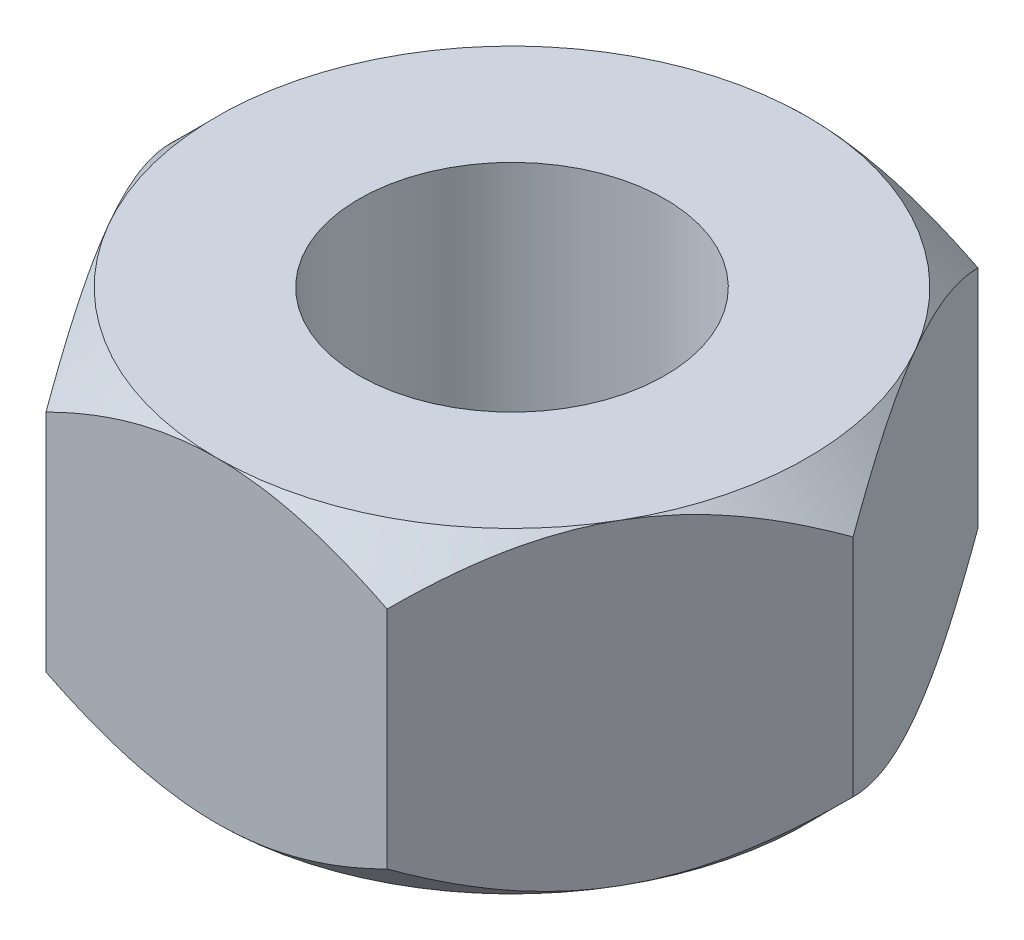
from build123d import *

# Parameters (mm, degrees)
BOSS_EXTRUDE1_DEPTH     = 15
SKETCH2_OUTSIDE_W       = 73.396
SKETCH2_OUTSIDE_H       = 69.064
SKETCH2_OUTSIDE_R       = 14
CUT_EXTRUDE1_DEPTH      = 15
CUT_EXTRUDE1_DRAFT      = -45
MIRROR1_COPY_1_SKETCH_W = 73.396
MIRROR1_COPY_1_SKETCH_H = 69.064
MIRROR1_COPY_1_SKETCH_R = 14
MIRROR1_COPY_1_DEPTH    = 15
MIRROR1_COPY_1_DRAFT    = -45
M16X1_5_TAPPED_HOLE1_D  = 14.5


with BuildPart() as part:
    # Sketch1 → Boss-Extrude1 (new body)
    with BuildSketch(Plane(origin=(0, 0, 0), x_dir=(1, 0, 0), z_dir=(0, 1, 0))):
        Polygon((16.165807537, 0), (8.082903769, 14), (-8.082903769, 14), (-16.165807537, 0), (-8.082903769, -14), (8.082903769, -14), align=None)
    extrude(amount=BOSS_EXTRUDE1_DEPTH)


with BuildPart() as cut_extrude1_tool:
    # Sketch2 outside → Cut-Extrude1 (with draft: the straight prism first)
    with BuildSketch(Plane(origin=(0, 15, 0), x_dir=(1, 0, 0), z_dir=(0, 1, 0))):
        Rectangle(SKETCH2_OUTSIDE_W, SKETCH2_OUTSIDE_H)
        Circle(SKETCH2_OUTSIDE_R, mode=Mode.SUBTRACT)
    extrude(amount=-CUT_EXTRUDE1_DEPTH)
    # Cut-Extrude1: the draft: its side faces are tilted about the plane it starts from
    cut_extrude1_sides = [cut_extrude1_tool.faces().sort_by_distance(p)[0] for p in [
        (0, 7.5, 34.532),
        (36.698, 7.5, 0),
        (0, 7.5, -34.532),
        (-36.698, 7.5, 0),
        (-14, 7.5, 0),
    ]]
    draft(cut_extrude1_sides, Plane(origin=(0, 15, 0), x_dir=(1, 0, 0), z_dir=(0, 1, 0)), CUT_EXTRUDE1_DRAFT)


with BuildPart() as part_1:
    add(part.part)

    # Cut-Extrude1: cut by cut_extrude1_tool
    add(cut_extrude1_tool.part, mode=Mode.SUBTRACT)


with BuildPart() as mirror1_copy_1_tool:
    # Mirror1 copy 1 sketch → Mirror1 copy 1 (with draft: the straight prism first)
    with BuildSketch(Plane.XZ):
        Rectangle(MIRROR1_COPY_1_SKETCH_W, MIRROR1_COPY_1_SKETCH_H)
        Circle(MIRROR1_COPY_1_SKETCH_R, mode=Mode.SUBTRACT)
    extrude(amount=-MIRROR1_COPY_1_DEPTH)
    # Mirror1 copy 1: the draft: its side faces are tilted about the plane it starts from
    mirror1_copy_1_sides = [mirror1_copy_1_tool.faces().sort_by_distance(p)[0] for p in [
        (0, 7.5, 34.532),
        (36.698, 7.5, 0),
        (0, 7.5, -34.532),
        (-36.698, 7.5, 0),
        (-14, 7.5, 0),
    ]]
    draft(mirror1_copy_1_sides, Plane.XZ, MIRROR1_COPY_1_DRAFT)


with BuildPart() as part_2:
    add(part_1.part)

    # Mirror1 copy 1: cut by mirror1_copy_1_tool
    add(mirror1_copy_1_tool.part, mode=Mode.SUBTRACT)

    # M16x1.5 Tapped Hole1 (through all)
    with Locations(Plane(origin=(0, 15, 0), x_dir=(1, 0, 0), z_dir=(0, 1, 0))):
        with Locations((0, 0)):
            Hole(M16X1_5_TAPPED_HOLE1_D / 2)


solid = part_2.part
